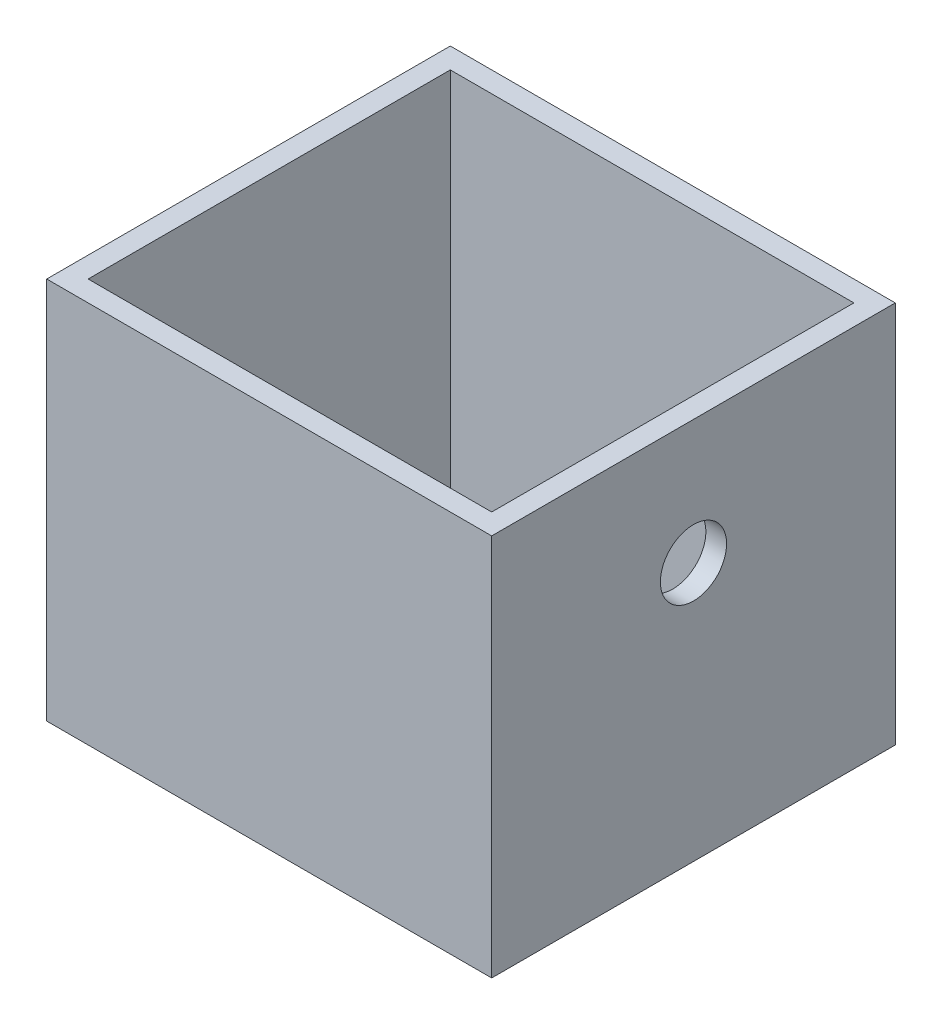
from build123d import *

# Parameters (mm, degrees)
SKETCH1_W           = 430
SKETCH1_H           = 390
BOSS_EXTRUDE1_DEPTH = 370
SHELL1_T            = -20
CUT_EXTRUDE2_REACH  = 601.854
SKETCH2_R           = 32


with BuildPart() as part:
    # Sketch1 → Boss-Extrude1 (new body)
    with BuildSketch(Plane(origin=(0, 0, 0), x_dir=(1, 0, 0), z_dir=(0, 1, 0))):
        Rectangle(SKETCH1_W, SKETCH1_H)
    extrude(amount=BOSS_EXTRUDE1_DEPTH)

    # Shell1
    shell1_openings = [part.faces().sort_by_distance(p)[0] for p in [
        (0, 370, 0),
    ]]
    offset(amount=SHELL1_T, openings=shell1_openings, kind=Kind.INTERSECTION)

    # Sketch2 → Cut-Extrude2 (cut, up to next)
    with BuildSketch(Plane(origin=(215, 0, 0), x_dir=(0, 0, -1), z_dir=(1, 0, 0)), mode=Mode.PRIVATE) as cut_extrude2_sk1:
        with Locations((0, 250)):
            Circle(SKETCH2_R)
    cut_extrude2_tool1 = extrude(cut_extrude2_sk1.sketch, amount=-CUT_EXTRUDE2_REACH, mode=Mode.PRIVATE) & part.part
    add(cut_extrude2_tool1.solids().sort_by_distance((215, 250, 0))[0], mode=Mode.SUBTRACT)


solid = part.part
